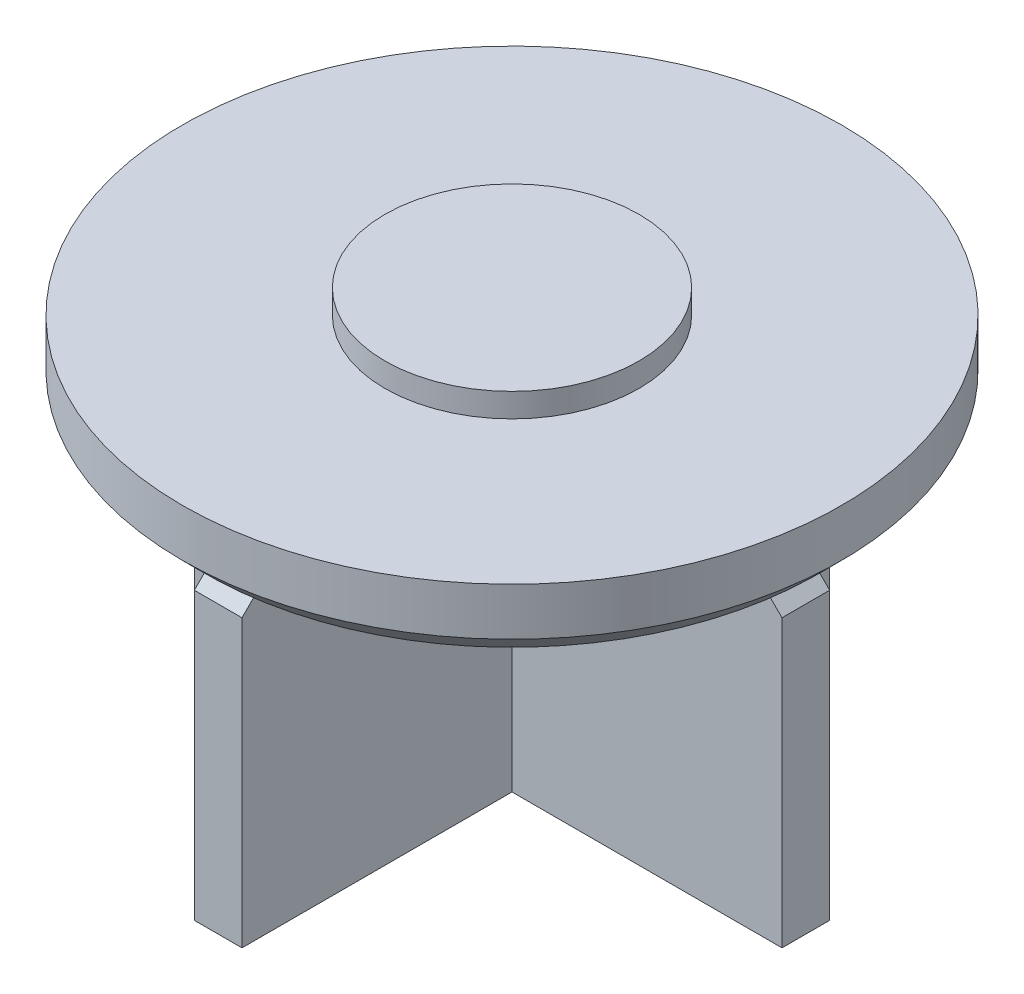
from build123d import *

# Parameters (mm, degrees)
ESTRUSIONE_ESTRUSIONE1_DEPTH = 3
RIPETIZIONECIRCOLARE1_COUNT  = 4


with BuildPart() as part:
    # Schizzo1 → Rivoluzione1 (revolve)
    with BuildSketch(Plane.XY, mode=Mode.PRIVATE) as rivoluzione1_sk:
        Polygon((0, 0), (-16, 0), (-16, -3), (-41.5, -3), (-41.5, -9), (-38.5, -12), (0, -12), align=None)
    revolve(rivoluzione1_sk.sketch.rotate(Axis((0, -12, 0), (0, 1, 0)), 270), axis=Axis((0, -12, 0), (0, 1, 0)))

    # Schizzo2 → Estrusione-Estrusione1 (add, symmetric)
    with BuildSketch(Plane.XY):
        Polygon((0, -12), (0, -52), (37, -52), (37, -16), (33, -12), align=None)
    estrusione_estrusione1 = extrude(amount=ESTRUSIONE_ESTRUSIONE1_DEPTH, both=True)

    # RipetizioneCircolare1: Estrusione-Estrusione1 ×4 about axis
    ripetizionecircolare1_axis = Axis((0, 0, 0), (0, 1, 0))
    for i in range(1, RIPETIZIONECIRCOLARE1_COUNT):
        add(estrusione_estrusione1.rotate(ripetizionecircolare1_axis, i * 360 / RIPETIZIONECIRCOLARE1_COUNT))


solid = part.part
